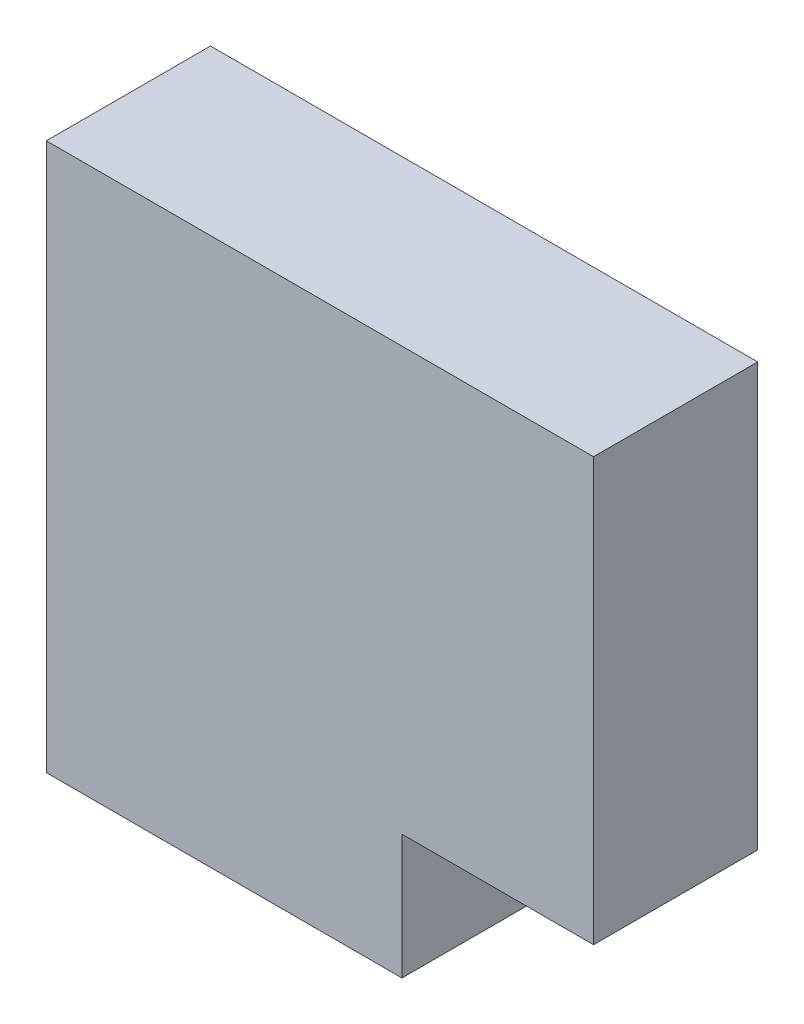
from build123d import *

# Parameters (mm, degrees)
SKETCH_1_W          = 20
SKETCH_1_H          = 20
EXTRUDE_1_DEPTH     = 6
SKETCH_2_W          = 7
SKETCH_2_H          = 4.552264216
CUT_EXTRUDE_1_DEPTH = 18.551364712


with BuildPart() as part:
    # 草圖1 → 填料-伸長1 (new body)
    with BuildSketch(Plane.XY):
        with Locations((2.238758582, 1.057268722)):
            Rectangle(SKETCH_1_W, SKETCH_1_H)
    extrude(amount=EXTRUDE_1_DEPTH)

    # 草圖2 → 除料-伸長1 (cut, through all)
    with BuildSketch(Plane.XY.offset(6)):
        with Locations((8.738758582, -6.66659917)):
            Rectangle(SKETCH_2_W, SKETCH_2_H)
    extrude(amount=-CUT_EXTRUDE_1_DEPTH, mode=Mode.SUBTRACT)


solid = part.part
